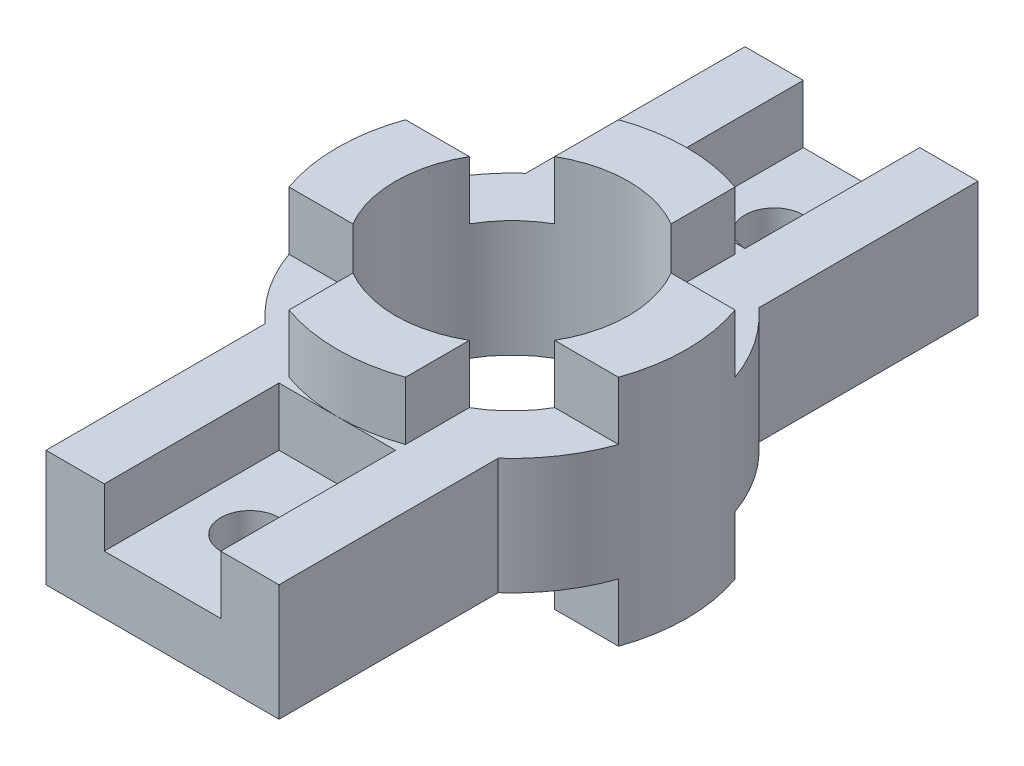
from build123d import *
from build123d.topology import SkipClean

# Parameters (mm, degrees)
SKETCH1_R           = 19.05
SKETCH1_R_2         = 12.7
BOSS_EXTRUDE1_DEPTH = 12.7
BOSS_EXTRUDE4_START = -19.05
BOSS_EXTRUDE4_DEPTH = 25.4
BOSS_EXTRUDE7_DEPTH = 12.7
CIRPATTERN3_COUNT   = 2
CIRPATTERN3_ANGLE   = 90
SKETCH14_W          = 12.7
SKETCH14_H          = 19.05
CUT_EXTRUDE1_DEPTH  = 6.35
SKETCH15_R          = 3.175
CUT_EXTRUDE2_DEPTH  = 6.35
CIRPATTERN4_COUNT   = 2


with BuildPart() as part:
    # Sketch1 → Boss-Extrude1 (new body)
    with BuildSketch(Plane(origin=(0, 0, 0), x_dir=(1, 0, 0), z_dir=(0, 1, 0))):
        with Locations(Location((0, 0, 0), (0, 0, 270))):
            Circle(SKETCH1_R)
        with Locations(Location((0, 0, 0), (0, 0, 270))):
            Circle(SKETCH1_R_2, mode=Mode.SUBTRACT)
    extrude(amount=BOSS_EXTRUDE1_DEPTH)

    # Sketch5 → Boss-Extrude4 (add)
    with SkipClean():  # the faces are left unmerged after this step: merging them gives an invalid solid
        with BuildSketch(Plane(origin=(0, 12.7, 0), x_dir=(1, 0, 0), z_dir=(0, 1, 0)).offset(BOSS_EXTRUDE4_START)):
            with BuildLine():
                ThreePointArc((-17.960512, 6.35), (-19.05, 0), (-17.960512, -6.35))
                Line((-17.960512, -6.35), (-10.998523, -6.35))
                ThreePointArc((-10.998523, -6.35), (-12.7, 0), (-10.998523, 6.35))
                Line((-10.998523, 6.35), (-17.960512, 6.35))
            make_face()
            with BuildLine():
                Line((10.998523, -6.35), (17.960512, -6.35))
                ThreePointArc((17.960512, -6.35), (18.775653, -3.221393), (19.05, 0))
                ThreePointArc((19.05, 0), (18.775653, 3.221393), (17.960512, 6.35))
                Line((17.960512, 6.35), (10.998523, 6.35))
                ThreePointArc((10.998523, 6.35), (12.267258, 3.287002), (12.7, 0))
                ThreePointArc((12.7, 0), (12.267258, -3.287002), (10.998523, -6.35))
            make_face()
        boss_extrude4 = extrude(amount=BOSS_EXTRUDE4_DEPTH)

    # Sketch13 → Boss-Extrude7 (add)
    with SkipClean():  # the faces are left unmerged after this step: merging them gives an invalid solid
        with BuildSketch(Plane.XZ):
            with BuildLine():
                ThreePointArc((0, 19.05), (6.797461, 17.795983), (12.7, 14.199032))
                Line((12.7, 14.199032), (12.7, 38.1))
                Line((12.7, 38.1), (-12.7, 38.1))
                Line((-12.7, 38.1), (-12.7, 14.199032))
                ThreePointArc((-12.7, 14.199032), (-6.797461, 17.795983), (0, 19.05))
            make_face()
        boss_extrude7 = extrude(amount=-BOSS_EXTRUDE7_DEPTH)

    # CirPattern3: Boss-Extrude4 ×2 about axis
    with SkipClean():  # the faces are left unmerged after this step: merging them gives an invalid solid
        cirpattern3_axis = Axis((0, 12.7, 0), (0, 1, 0))
        for i in range(1, CIRPATTERN3_COUNT):
            add(boss_extrude4.rotate(cirpattern3_axis, i * CIRPATTERN3_ANGLE / (CIRPATTERN3_COUNT - 1)))

    # Sketch14 → Cut-Extrude1 (cut)
    with SkipClean():  # the faces are left unmerged after this step: merging them gives an invalid solid
        with BuildSketch(Plane(origin=(0, 12.7, 0), x_dir=(1, 0, 0), z_dir=(0, 1, 0))):
            with Locations((0, -28.575)):
                Rectangle(SKETCH14_W, SKETCH14_H)
        cut_extrude1 = extrude(amount=-CUT_EXTRUDE1_DEPTH, mode=Mode.SUBTRACT)

    # Sketch15 → Cut-Extrude2 (cut)
    with SkipClean():  # the faces are left unmerged after this step: merging them gives an invalid solid
        with BuildSketch(Plane(origin=(0, 6.35, 0), x_dir=(1, 0, 0), z_dir=(0, 1, 0))):
            with Locations(Location((0, -28.575, 0), (0, 0, 270))):
                Circle(SKETCH15_R)
        cut_extrude2 = extrude(amount=-CUT_EXTRUDE2_DEPTH, mode=Mode.SUBTRACT)

    # CirPattern4: Boss-Extrude7, Cut-Extrude1, Cut-Extrude2 ×2 about axis
    cirpattern4_axis = Axis((0, 0, 0), (0, 1, 0))
    add([boss_extrude7.rotate(cirpattern4_axis, i * 360 / CIRPATTERN4_COUNT) for i in range(1, CIRPATTERN4_COUNT)])
    add([cut_extrude1.rotate(cirpattern4_axis, i * 360 / CIRPATTERN4_COUNT) for i in range(1, CIRPATTERN4_COUNT)], mode=Mode.SUBTRACT)
    add([cut_extrude2.rotate(cirpattern4_axis, i * 360 / CIRPATTERN4_COUNT) for i in range(1, CIRPATTERN4_COUNT)], mode=Mode.SUBTRACT)


solid = part.part
